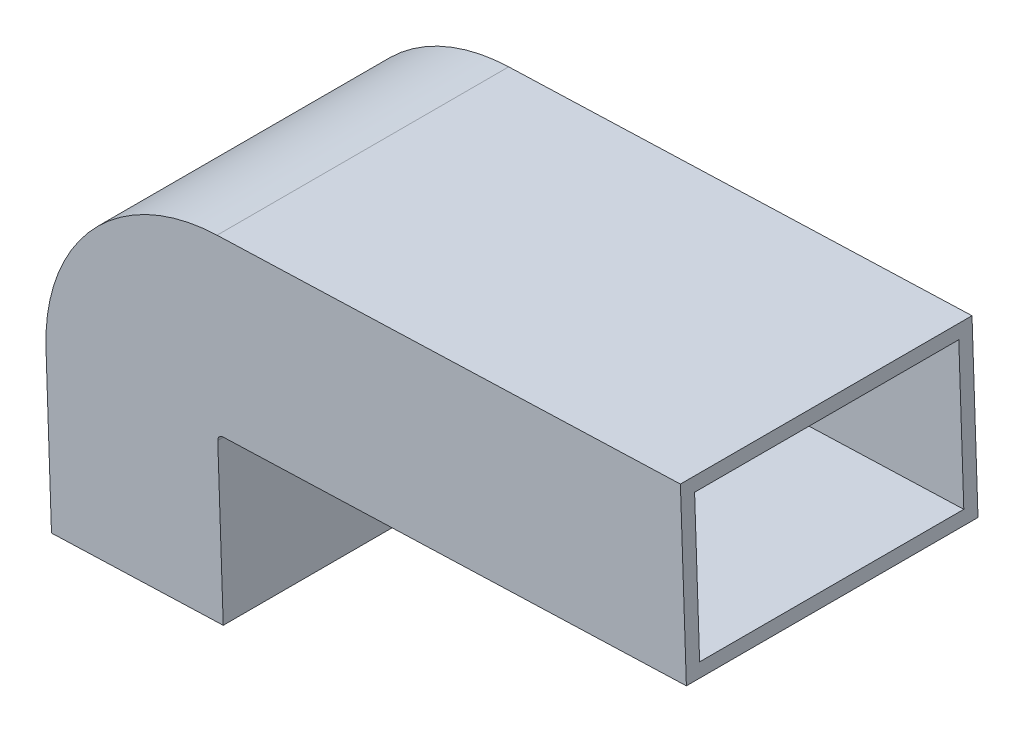
from build123d import *

# Parameters (mm, degrees)
SKETCH2_W   = 63.80012688
SKETCH2_H   = 37.602651942
SKETCH2_W_2 = 57.80012688
SKETCH2_H_2 = 31.602651942


with BuildPart() as part:
    # Sweep-Thin1: sweep along a path in Sketch1
    with BuildLine(Plane.XY) as sweep_thin1_path:
        Line((-43.035286794, -24.171802054), (-44.234672924, 10.250579859))
        ThreePointArc((-44.234672924, 10.250579859), (-38.872819675, 24.588121657), (-24.943243853, 30.934891896))
        Line((-24.943243853, 30.934891896), (76.426266413, 34.466930581))
    # Sketch2 → Sweep-Thin1 (sweep)
    with BuildSketch(Plane(origin=(76.426266413, 34.466930581, 0), x_dir=(0, 0, -1), z_dir=(0.999393527672129, 0.034822074134917426, 0))):
        Rectangle(SKETCH2_W, SKETCH2_H)
        Rectangle(SKETCH2_W_2, SKETCH2_H_2, mode=Mode.SUBTRACT)
    sweep(path=sweep_thin1_path.line)


solid = part.part
